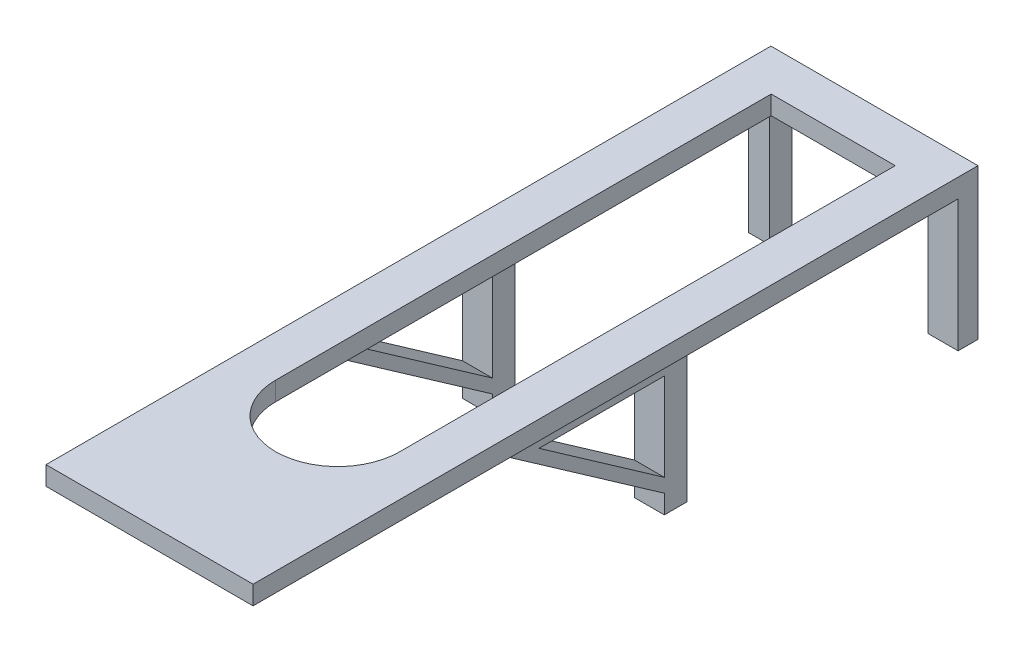
from build123d import *

# Parameters (mm, degrees)
ESQUISSE2_W             = 8
ESQUISSE2_H             = 5.3
BOSS_EXTRU_1_DEPTH      = 35
ESQUISSE2_W_2           = 5.6
ESQUISSE2_H_2           = 5.93
BOSS_EXTRU_1_2_DEPTH    = 35
ESQUISSE2_H_3           = 6
BOSS_EXTRU_1_3_DEPTH    = 35
BOSS_EXTRU_1_4_DEPTH    = 35
ESQUISSE3_W             = 55.06
ESQUISSE3_H             = 192.755
BOSS_EXTRU_2_DEPTH      = 5
ESQUISSE8_W             = 0.5
ESQUISSE8_H             = 25
ENL_V_MAT_EXTRU_3_DEPTH = 3.5
ESQUISSE9_W             = 25
ESQUISSE9_H             = 0.5
ENL_V_MAT_EXTRU_4_DEPTH = 3.5
BOSS_EXTRU_3_DEPTH      = 8
BOSS_EXTRU_4_DEPTH      = 8
ESQUISSE15_R            = 1.6
ENL_V_MAT_EXTRU_5_DEPTH = 15
ENL_V_MAT_EXTRU_8_DEPTH = 128.416796872
ENL_V_MAT_EXTRU_9_REACH = 133.156


with BuildPart() as part:
    # Esquisse2 → Boss.-Extru.1 (new body)
    with BuildSketch(Plane(origin=(0, 0, 0), x_dir=(1, 0, 0), z_dir=(0, 1, 0))):
        with Locations((59.173, 105.105)):
            Rectangle(ESQUISSE2_W, ESQUISSE2_H)
    extrude(amount=BOSS_EXTRU_1_DEPTH)



with BuildPart() as body_2:
    # Esquisse2 → Boss.-Extru.1 2 (new body)
    with BuildSketch(Plane(origin=(0, 0, 0), x_dir=(1, 0, 0), z_dir=(0, 1, 0))):
        with Locations((10.913, 104.79)):
            Rectangle(ESQUISSE2_W_2, ESQUISSE2_H_2)
    extrude(amount=BOSS_EXTRU_1_2_DEPTH)


with BuildPart() as body_3:
    # Esquisse2 → Boss.-Extru.1 3 (new body)
    with BuildSketch(Plane(origin=(0, 0, 0), x_dir=(1, 0, 0), z_dir=(0, 1, 0))):
        with Locations((12.183, 28.625)):
            Rectangle(ESQUISSE2_W, ESQUISSE2_H_3)
    extrude(amount=BOSS_EXTRU_1_3_DEPTH)


with BuildPart() as body_4:
    # Esquisse2 → Boss.-Extru.1 4 (new body)
    with BuildSketch(Plane(origin=(0, 0, 0), x_dir=(1, 0, 0), z_dir=(0, 1, 0))):
        with Locations((57.903, 28.625)):
            Rectangle(ESQUISSE2_W, ESQUISSE2_H_3)
    extrude(amount=BOSS_EXTRU_1_4_DEPTH)


with BuildPart() as part_1:
    add(part.part)

    add(body_2.part)  # Boss.-Extru.2 merges body 2

    add(body_3.part)  # Boss.-Extru.2 merges body 3

    add(body_4.part)  # Boss.-Extru.2 merges body 4
    # Esquisse3 → Boss.-Extru.2 (add)
    with BuildSketch(Plane(origin=(0, 35, 0), x_dir=(1, 0, 0), z_dir=(0, 1, 0))):
        with Locations((35.643, 11.3775)):
            Rectangle(ESQUISSE3_W, ESQUISSE3_H)
    extrude(amount=BOSS_EXTRU_2_DEPTH)

    # Esquisse8 → Enlèv. mat.-Extru.3 (cut)
    with BuildSketch(Plane(origin=(0, 35, 0), x_dir=(1, 0, 0), z_dir=(0, 1, 0))):
        with Locations((54.923, -71.5)):
            Rectangle(ESQUISSE8_W, ESQUISSE8_H)
        with Locations((60.423, -71.5)):
            Rectangle(ESQUISSE8_W, ESQUISSE8_H)
        with Locations((49.423, -71.5)):
            Rectangle(ESQUISSE8_W, ESQUISSE8_H)
        with Locations((43.923, -71.5)):
            Rectangle(ESQUISSE8_W, ESQUISSE8_H)
        with Locations((38.423, -71.5)):
            Rectangle(ESQUISSE8_W, ESQUISSE8_H)
        with Locations((32.923, -71.5)):
            Rectangle(ESQUISSE8_W, ESQUISSE8_H)
        with Locations((27.423, -71.5)):
            Rectangle(ESQUISSE8_W, ESQUISSE8_H)
        with Locations((21.923, -71.5)):
            Rectangle(ESQUISSE8_W, ESQUISSE8_H)
        with Locations((16.423, -71.5)):
            Rectangle(ESQUISSE8_W, ESQUISSE8_H)
        with Locations((10.923, -71.5)):
            Rectangle(ESQUISSE8_W, ESQUISSE8_H)
    extrude(amount=ENL_V_MAT_EXTRU_3_DEPTH, mode=Mode.SUBTRACT)

    # Esquisse9 → Enlèv. mat.-Extru.4 (cut)
    with BuildSketch(Plane(origin=(0, 35, 0), x_dir=(1, 0, 0), z_dir=(0, 1, 0))):
        with Locations((49.673, -79.75)):
            Rectangle(ESQUISSE9_W, ESQUISSE9_H)
        with Locations((21.613, -79.75)):
            Rectangle(ESQUISSE9_W, ESQUISSE9_H)
        with Locations((49.673, -76.75)):
            Rectangle(ESQUISSE9_W, ESQUISSE9_H)
        with Locations((21.613, -76.75)):
            Rectangle(ESQUISSE9_W, ESQUISSE9_H)
        with Locations((49.673, -73.75)):
            Rectangle(ESQUISSE9_W, ESQUISSE9_H)
        with Locations((21.613, -73.75)):
            Rectangle(ESQUISSE9_W, ESQUISSE9_H)
        with Locations((49.673, -70.75)):
            Rectangle(ESQUISSE9_W, ESQUISSE9_H)
        with Locations((21.613, -70.75)):
            Rectangle(ESQUISSE9_W, ESQUISSE9_H)
        with Locations((49.673, -67.75)):
            Rectangle(ESQUISSE9_W, ESQUISSE9_H)
        with Locations((21.613, -67.75)):
            Rectangle(ESQUISSE9_W, ESQUISSE9_H)
        with Locations((49.673, -64.75)):
            Rectangle(ESQUISSE9_W, ESQUISSE9_H)
        with Locations((21.613, -64.75)):
            Rectangle(ESQUISSE9_W, ESQUISSE9_H)
        with Locations((49.673, -61.75)):
            Rectangle(ESQUISSE9_W, ESQUISSE9_H)
        with Locations((21.613, -61.75)):
            Rectangle(ESQUISSE9_W, ESQUISSE9_H)
    extrude(amount=ENL_V_MAT_EXTRU_4_DEPTH, mode=Mode.SUBTRACT)

    # Esquisse13 → Boss.-Extru.3 (add)
    with BuildSketch(Plane(origin=(61.903, 0, 0), x_dir=(0, 0, -1), z_dir=(1, 0, 0))):
        Polygon((25.625, 5), (-17.219440202, 35), (25.625, 35), align=None)
    extrude(amount=-BOSS_EXTRU_3_DEPTH)

    # Esquisse14 → Boss.-Extru.4 (add)
    with BuildSketch(Plane.ZY.offset(-8.183)):
        Polygon((-25.625, 5), (17.219440202, 35), (-25.625, 35), align=None)
    extrude(amount=-BOSS_EXTRU_4_DEPTH)

    # Esquisse15 → Enlèv. mat.-Extru.5 (cut)
    with BuildSketch(Plane(origin=(0, 0, 0), x_dir=(-1, 0, 0), z_dir=(0, -1, 0))):
        with Locations(Location((-12.183, 29.625, 0), (0, 0, 90))):
            Circle(ESQUISSE15_R)
        with Locations(Location((-57.903, 29.625, 0), (0, 0, 90))):
            Circle(ESQUISSE15_R)
        with Locations(Location((-10.913, 105.825, 0), (0, 0, 90))):
            Circle(ESQUISSE15_R)
        with Locations(Location((-59.173, 104.555, 0), (0, 0, 90))):
            Circle(ESQUISSE15_R)
    extrude(amount=-ENL_V_MAT_EXTRU_5_DEPTH, mode=Mode.SUBTRACT)

    # Esquisse19 → Enlèv. mat.-Extru.8 (cut, through all)
    with BuildSketch(Plane.ZY.offset(-8.183)):
        Polygon((-25.625, 8.662323766), (7.704655795, 32), (-25.625, 32), align=None)
    extrude(amount=-ENL_V_MAT_EXTRU_8_DEPTH, mode=Mode.SUBTRACT)

    # Esquisse20 → Enlèv. mat.-Extru.9 (cut, up to next)
    with BuildSketch(Plane(origin=(0, 40, 0), x_dir=(1, 0, 0), z_dir=(0, 1, 0)), mode=Mode.PRIVATE) as enl_v_mat_extru_9_sk1:
        with BuildLine():
            Line((19.183, 96.755), (52.173, 96.755))
            Line((52.173, 96.755), (52.173, -35))
            ThreePointArc((52.173, -35), (35.678, -51.495), (19.183, -35))
            Line((19.183, -35), (19.183, 96.755))
        make_face()
    enl_v_mat_extru_9_tool1 = extrude(enl_v_mat_extru_9_sk1.sketch, amount=-ENL_V_MAT_EXTRU_9_REACH, mode=Mode.PRIVATE) & part_1.part
    add(enl_v_mat_extru_9_tool1.solids().sort_by_distance((35.678, 40, -24.353096))[0], mode=Mode.SUBTRACT)


solid = part_1.part
